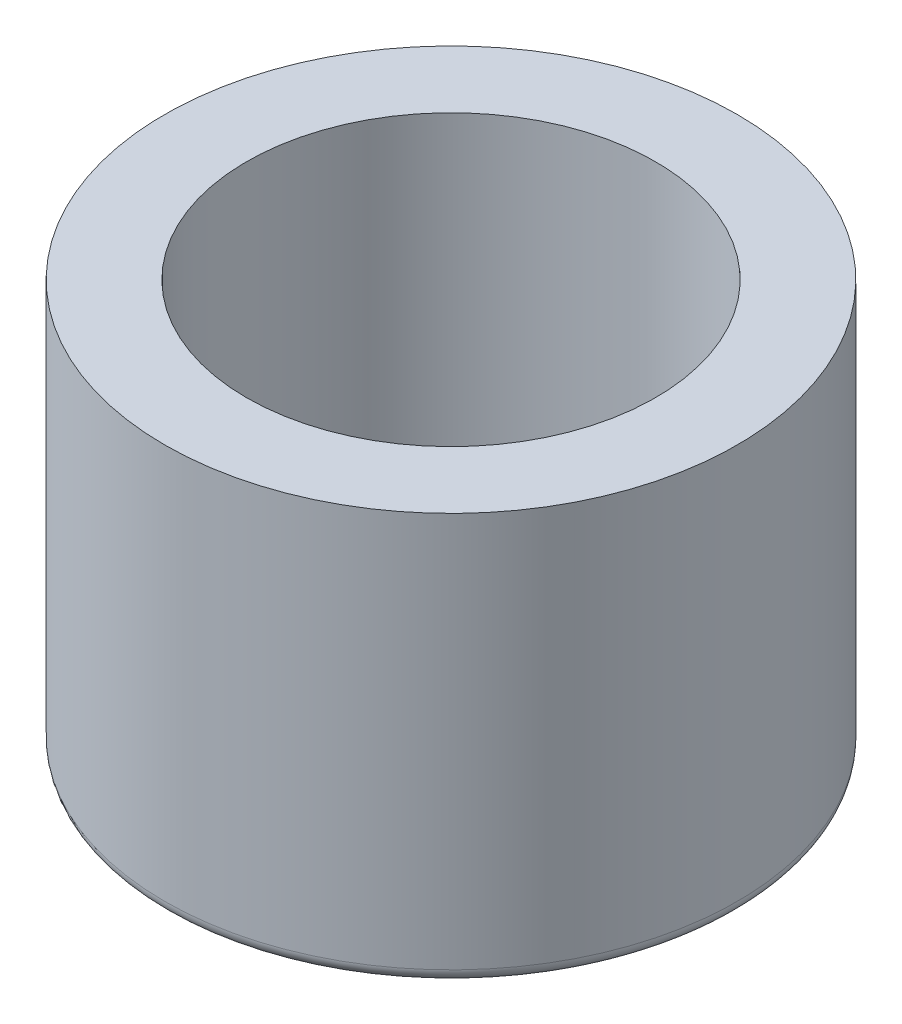
from build123d import *

# Parameters (mm, degrees)
SKETCH1_R           = 10.5
BOSS_EXTRUDE1_DEPTH = 15
SKETCH2_R           = 7.5
CUT_EXTRUDE1_DEPTH  = 15
FILLET1_R           = 0.5


with BuildPart() as part:
    # Sketch1 → Boss-Extrude1 (new body)
    with BuildSketch(Plane(origin=(0, 0, 0), x_dir=(1, 0, 0), z_dir=(0, 1, 0))):
        with Locations(Location((0, 0, 0), (0, 0, 270))):
            Circle(SKETCH1_R)
    extrude(amount=BOSS_EXTRUDE1_DEPTH)

    # Sketch2 → Cut-Extrude1 (cut)
    with BuildSketch(Plane(origin=(0, 15, 0), x_dir=(1, 0, 0), z_dir=(0, 1, 0))):
        with Locations(Location((0, 0, 0), (0, 0, 270))):
            Circle(SKETCH2_R)
    extrude(amount=-CUT_EXTRUDE1_DEPTH, mode=Mode.SUBTRACT)

    # Fillet1
    fillet1_edges = [part.edges().sort_by_distance(p)[0] for p in [
        (0, 0, -10.5),
    ]]
    fillet(fillet1_edges, radius=FILLET1_R)


solid = part.part
